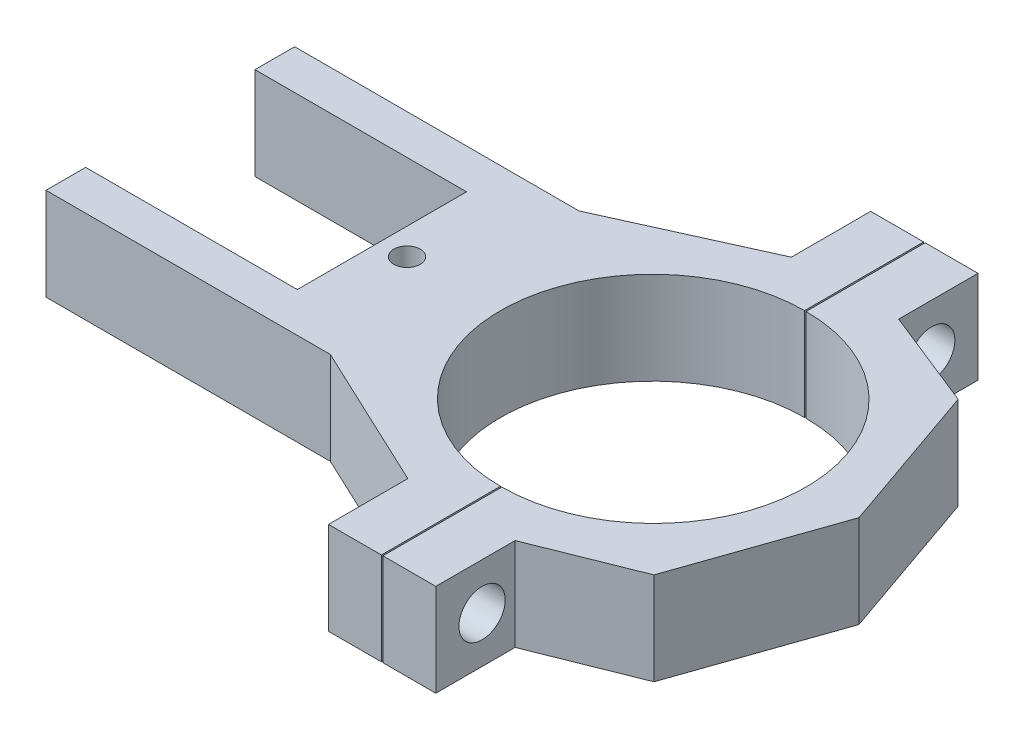
from build123d import *

# Parameters (mm, degrees)
EXTRUDE_1_DEPTH     = 7
EXTRUDE_2_DEPTH     = 7
SKETCH_6_R          = 1.75
CUT_EXTRUDE_1_DEPTH = 42.039863202
SKETCH_4_R          = 1.75
CUT_EXTRUDE_2_DEPTH = 42.039863202
SKETCH_7_R          = 1
CUT_EXTRUDE_3_DEPTH = 47.252916804


with BuildPart() as part:
    # Эскиз1 → Бобышка-Вытянуть1 (new body)
    with BuildSketch(Plane(origin=(0, 0, 0), x_dir=(1, 0, 0), z_dir=(0, 1, 0))):
        with BuildLine():
            Line((-13.247814837, 6.017090357), (-13.247814837, 3.017090357))
            Line((-13.247814837, 3.017090357), (2.752185163, 3.017090357))
            Line((2.752185163, 3.017090357), (2.752185163, -9.782909643))
            Line((2.752185163, -9.782909643), (-13.247814837, -9.782909643))
            Line((-13.247814837, -9.782909643), (-13.247814837, -12.782909643))
            Line((-13.247814837, -12.782909643), (8.252185163, -12.782909643))
            Line((8.252185163, -12.782909643), (19.311214889, -17.982909643))
            Line((19.311214889, -17.982909643), (19.311214889, -23.982909643))
            Line((19.311214889, -23.982909643), (23.311214889, -23.982909643))
            Line((23.311214889, -23.982909643), (23.311214889, -14.982909643))
            ThreePointArc((23.311214889, -14.982909643), (11.811214889, -3.482909643), (23.311214889, 8.017090357))
            Line((23.311214889, 8.017090357), (23.311214889, 17.017090357))
            Line((23.311214889, 17.017090357), (19.311214889, 17.017090357))
            Line((19.311214889, 17.017090357), (19.311214889, 11.017090357))
            Line((19.311214889, 11.017090357), (8.252185163, 6.017090357))
            Line((8.252185163, 6.017090357), (-13.247814837, 6.017090357))
        make_face()
    extrude(amount=EXTRUDE_1_DEPTH)


with BuildPart() as body_2:
    # Эскиз2 → Бобышка-Вытянуть2 (new body)
    with BuildSketch(Plane(origin=(0, 0, 0), x_dir=(1, 0, 0), z_dir=(0, 1, 0))):
        with BuildLine():
            Line((23.424958034, -14.982347129), (23.424958034, -23.982347129))
            Line((23.424958034, -23.982347129), (27.424958034, -23.982347129))
            Line((27.424958034, -23.982347129), (27.424958034, -17.982347129))
            Line((27.424958034, -17.982347129), (34.924395521, -14.982347129))
            Line((34.924395521, -14.982347129), (38.924958034, -3.482909643))
            Line((38.924958034, -3.482909643), (34.924395521, 8.016527843))
            Line((34.924395521, 8.016527843), (27.424958034, 11.016527843))
            Line((27.424958034, 11.016527843), (27.424958034, 17.016527843))
            Line((27.424958034, 17.016527843), (23.424958034, 17.016527843))
            Line((23.424958034, 17.016527843), (23.424958034, 8.016527843))
            ThreePointArc((23.424958034, 8.016527843), (34.924395521, -3.482909643), (23.424958034, -14.982347129))
        make_face()
    extrude(amount=EXTRUDE_2_DEPTH)


with BuildPart() as cut_extrude_1_tool:
    # Эскиз6 → Вырез-Вытянуть1 (new, through all)
    with BuildSketch(Plane.ZY.offset(-19.311214889)):
        with Locations((20.482909643, 3.5)):
            Circle(SKETCH_6_R)
    extrude(amount=-CUT_EXTRUDE_1_DEPTH)


with BuildPart() as part_1:
    add(part.part)

    # Вырез-Вытянуть1: cut by cut_extrude_1_tool
    add(cut_extrude_1_tool.part, mode=Mode.SUBTRACT)


with BuildPart() as body_2_1:
    add(body_2.part)

    # Вырез-Вытянуть1: cut by cut_extrude_1_tool
    add(cut_extrude_1_tool.part, mode=Mode.SUBTRACT)


with BuildPart() as cut_extrude_2_tool:
    # Эскиз4 → Вырез-Вытянуть2 (new, through all)
    with BuildSketch(Plane.ZY.offset(-19.311214889)):
        with Locations((-13.517090357, 3.5)):
            Circle(SKETCH_4_R)
    extrude(amount=-CUT_EXTRUDE_2_DEPTH)


with BuildPart() as part_2:
    add(part_1.part)

    # Вырез-Вытянуть2: cut by cut_extrude_2_tool
    add(cut_extrude_2_tool.part, mode=Mode.SUBTRACT)

    # Эскиз7 → Вырез-Вытянуть3 (cut, through all)
    with BuildSketch(Plane(origin=(0, 7, 0), x_dir=(1, 0, 0), z_dir=(0, 1, 0))):
        with Locations(Location((4.749689841, -3.482784877, 0), (0, 0, 270))):
            Circle(SKETCH_7_R)
    extrude(amount=-CUT_EXTRUDE_3_DEPTH, mode=Mode.SUBTRACT)


with BuildPart() as body_2_2:
    add(body_2_1.part)

    # Вырез-Вытянуть2: cut by cut_extrude_2_tool
    add(cut_extrude_2_tool.part, mode=Mode.SUBTRACT)


solid = Compound([part_2.part, body_2_2.part])
